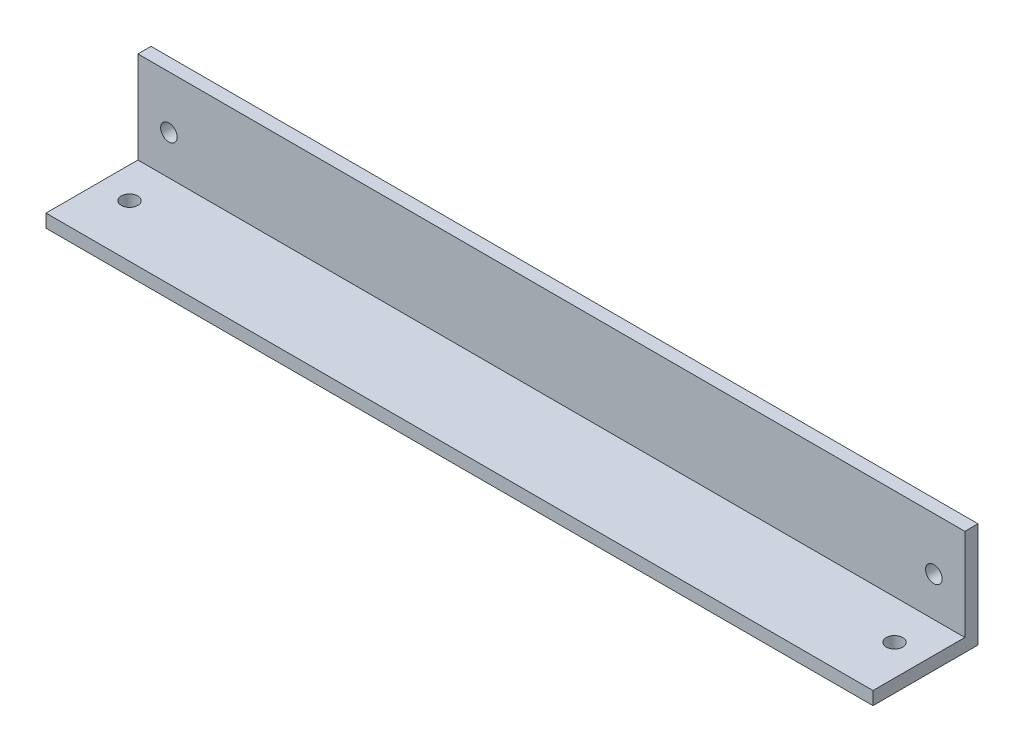
from build123d import *

# Parameters (mm, degrees)
BOSS_EXTRUDE1_DEPTH = 200
CUT_EXTRUDE1_REACH  = 214.512
SKETCH2_R           = 4


with BuildPart() as part:
    # Sketch1 → Boss-Extrude1 (new, symmetric)
    with BuildSketch(Plane(origin=(0, 0, 0), x_dir=(0, 0, -1), z_dir=(1, 0, 0))):
        Polygon((0, 50.8), (0, 0), (-50.8, 0), (-50.8, 6.35), (-6.35, 6.35), (-6.35, 50.8), align=None)
    extrude(amount=BOSS_EXTRUDE1_DEPTH, both=True)

    # Sketch2 → Cut-Extrude1 (cut, up to next)
    with BuildSketch(Plane.XZ, mode=Mode.PRIVATE) as cut_extrude1_sk1:
        with Locations(Location((-185, 25.4, 0), (0, 0, 270))):
            Circle(SKETCH2_R)
    cut_extrude1_tool1 = extrude(cut_extrude1_sk1.sketch, amount=-CUT_EXTRUDE1_REACH, mode=Mode.PRIVATE) & part.part
    # Sketch2 → Cut-Extrude1 (cut, up to next)
    with BuildSketch(Plane.XZ, mode=Mode.PRIVATE) as cut_extrude1_sk2:
        with Locations(Location((185, 25.4, 0), (0, 0, 270))):
            Circle(SKETCH2_R)
    cut_extrude1_tool2 = extrude(cut_extrude1_sk2.sketch, amount=-CUT_EXTRUDE1_REACH, mode=Mode.PRIVATE) & part.part
    cut_extrude1_1 = cut_extrude1_tool1.solids().sort_by_distance((-185, 0, 25.4))[0]
    add(cut_extrude1_1, mode=Mode.SUBTRACT)
    cut_extrude1_2 = cut_extrude1_tool2.solids().sort_by_distance((185, 0, 25.4))[0]
    add(cut_extrude1_2, mode=Mode.SUBTRACT)
    cut_extrude1 = cut_extrude1_1 + cut_extrude1_2  # Cut-Extrude1 as one shape, for the pattern or mirror that repeats it

    # Mirror1: Cut-Extrude1 across plane
    add(cut_extrude1.mirror(Plane(origin=(0, 0, 0), x_dir=(0, 0.7071067811865471, 0.7071067811865479), z_dir=(0, -0.7071067811865479, 0.7071067811865471))), mode=Mode.SUBTRACT)


solid = part.part
